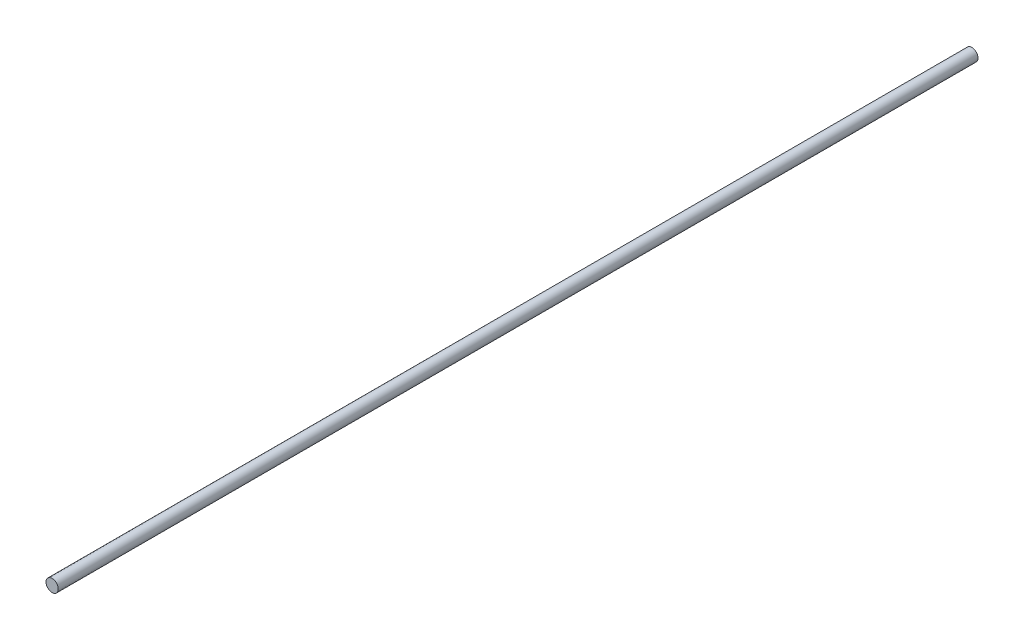
from build123d import *

# Parameters (mm, degrees)
SKETCH1_R           = 1
BOSS_EXTRUDE1_DEPTH = 150


with BuildPart() as part:
    # Sketch1 → Boss-Extrude1 (new body)
    with BuildSketch(Plane.XY):
        Circle(SKETCH1_R)
    extrude(amount=BOSS_EXTRUDE1_DEPTH)


solid = part.part
